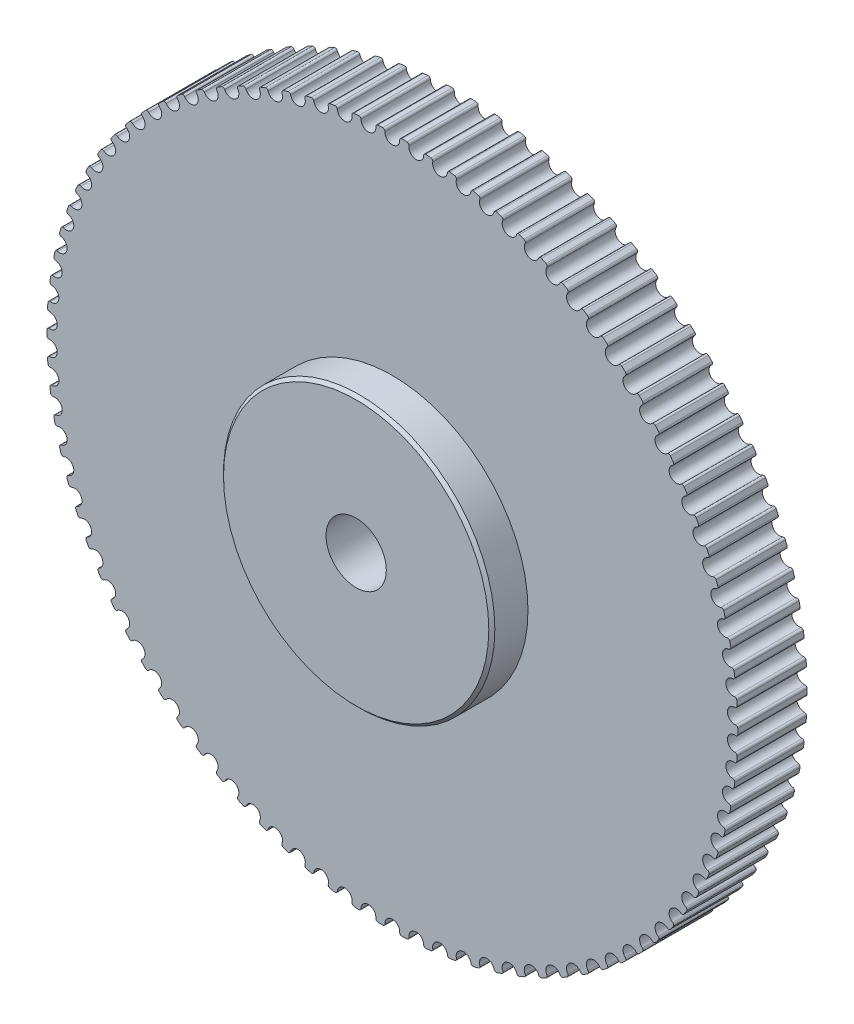
from build123d import *

# Parameters (mm, degrees)
Y_KSEKLIK_EKSTR_ZYON1_DEPTH = 23
IZIM2_R                     = 45
Y_KSEKLIK_EKSTR_ZYON2_DEPTH = 12
IZIM3_R                     = 10
KES_EKSTR_ZYON1_DEPTH       = 94
PAH1_SIZE                   = 1


with BuildPart() as part:
    # Çizim1 → Yükseklik-Ekstrüzyon1 (new body)
    with BuildSketch(Plane.XY):
        with BuildLine():
            ThreePointArc((0, 111.23), (1.781971913, 111.994070727), (2.456990514, 113.811645447))
            ThreePointArc((2.456990514, 113.811645447), (2.655804987, 114.335821771), (3.175532645, 114.545991167))
            ThreePointArc((3.175532645, 114.545991167), (3.999133327, 114.520194868), (4.822527218, 114.488476849))
            ThreePointArc((4.822527218, 114.488476849), (5.32632817, 114.242565047), (5.488093649, 113.705796993))
            ThreePointArc((5.488093649, 113.705796993), (6.034680335, 111.845562876), (7.759012575, 110.95904931))
            ThreePointArc((7.759012575, 110.95904931), (9.589942573, 111.596954722), (10.390104466, 113.363015005))
            ThreePointArc((10.390104466, 113.363015005), (10.624999329, 113.872045865), (11.158121632, 114.04544893))
            ThreePointArc((11.158121632, 114.04544893), (11.977916606, 113.96226399), (12.797092214, 113.87318618))
            ThreePointArc((12.797092214, 113.87318618), (13.282511991, 113.592730029), (13.406440371, 113.045985326))
            ThreePointArc((13.406440371, 113.045985326), (13.821932227, 111.152154686), (15.48022402, 110.147517286))
            ThreePointArc((15.48022402, 110.147517286), (17.351191997, 110.656149572), (18.272598873, 112.362091348))
            ThreePointArc((18.272598873, 112.362091348), (18.542429742, 112.853496798), (19.086349373, 112.98928873))
            ThreePointArc((19.086349373, 112.98928873), (19.898344679, 112.849120418), (20.709311062, 112.703116795))
            ThreePointArc((20.709311062, 112.703116795), (21.173984749, 112.389482649), (21.259472264, 111.835424982))
            ThreePointArc((21.259472264, 111.835424982), (21.541845055, 109.917224371), (23.12601737, 108.79935763))
            ThreePointArc((23.12601737, 108.79935763), (25.027908158, 109.176238784), (26.066071016, 110.813750878))
            ThreePointArc((26.066071016, 110.813750878), (26.369523302, 111.285136838), (26.921590338, 111.382656072))
            ThreePointArc((26.921590338, 111.382656072), (27.721830017, 111.186187274), (28.520636229, 110.983969154))
            ThreePointArc((28.520636229, 110.983969154), (28.962299982, 110.638685006), (29.008930144, 110.080013689))
            ThreePointArc((29.008930144, 110.080013689), (29.156808179, 108.146788388), (30.659143088, 106.921138439))
            ThreePointArc((30.659143088, 106.921138439), (32.582690866, 107.164432335), (33.73255188, 108.725536952))
            ThreePointArc((33.73255188, 108.725536952), (34.068147194, 109.174606878), (34.625672021, 109.233378311))
            ThreePointArc((34.625672021, 109.233378311), (35.410257385, 108.981566202), (36.193011723, 108.724118771))
            ThreePointArc((36.193011723, 108.724118771), (36.609513801, 108.348866812), (36.617059433, 107.788303634))
            ThreePointArc((36.617059433, 107.788303634), (36.629722264, 105.849472123), (38.042900542, 104.52201021))
            ThreePointArc((38.042900542, 104.52201021), (39.978733979, 104.630531544), (41.234691143, 106.107623138))
            ThreePointArc((41.234691143, 106.107623138), (41.600794498, 106.532189208), (42.16106091, 106.55192651))
            ThreePointArc((42.16106091, 106.55192651), (42.92616954, 106.245997895), (43.689058502, 105.93457541))
            ThreePointArc((43.689058502, 105.93457541), (44.078369748, 105.53118383), (44.046794089, 104.971459799))
            ThreePointArc((44.046794089, 104.971459799), (43.924180025, 103.036467869), (45.241316809, 101.613661254))
            ThreePointArc((45.241316809, 101.613661254), (47.180004719, 101.586881321), (48.535939136, 102.972763651))
            ThreePointArc((48.535939136, 102.972763651), (48.930766913, 103.37075742), (49.491045348, 103.351364434))
            ThreePointArc((49.491045348, 103.351364434), (50.232949711, 102.992809765), (50.972256579, 102.628929446))
            ThreePointArc((50.972256579, 102.628929446), (51.332480309, 102.199363528), (51.261937191, 101.643205563))
            ThreePointArc((51.261937191, 101.643205563), (51.004643595, 99.721480302), (52.219321929, 98.210260754))
            ThreePointArc((52.219321929, 98.210260754), (54.151419218, 98.048310024), (55.600724911, 99.336231211))
            ThreePointArc((55.600724911, 99.336231211), (56.02235355, 99.705713693), (56.579914389, 99.647284899))
            ThreePointArc((56.579914389, 99.647284899), (57.295, 99.23785102), (58.007122946, 98.823285654))
            ThreePointArc((58.007122946, 98.823285654), (58.336504185, 98.3696382), (58.227337289, 97.819755847))
            ThreePointArc((58.227337289, 97.819755847), (57.836617669, 95.920659706), (58.942919761, 94.328389735))
            ThreePointArc((58.942919761, 94.328389735), (60.859013447, 94.032057215), (62.394629544, 95.215742637))
            ThreePointArc((62.394629544, 95.215742637), (62.841004911, 95.554913751), (63.393131774, 95.457733809))
            ThreePointArc((63.393131774, 95.457733809), (64.077914809, 94.999415439), (64.759384441, 94.536184748))
            ThreePointArc((64.759384441, 94.536184748), (65.056318478, 94.060665883), (64.909059652, 93.519738114))
            ThreePointArc((64.909059652, 93.519738114), (64.386817556, 91.652523298), (65.379353612, 89.986960284))
            ThreePointArc((65.379353612, 89.986960284), (67.270108679, 89.557689676), (68.884553814, 90.631372535))
            ThreePointArc((68.884553814, 90.631372535), (69.353501214, 90.938579874), (69.897504193, 90.803122235))
            ThreePointArc((69.897504193, 90.803122235), (70.548648458, 90.298152256), (71.196144725, 89.788513053))
            ThreePointArc((71.196144725, 89.788513053), (71.459184926, 89.293439457), (71.274551602, 88.764101616))
            ThreePointArc((71.274551602, 88.764101616), (70.623331339, 86.937865009), (71.497265825, 85.207123408))
            ThreePointArc((71.497265825, 85.207123408), (73.353470704, 84.647006076), (75.038879461, 85.605455498))
            ThreePointArc((75.038879461, 85.605455498), (75.52811423, 85.879202378), (76.061342998, 85.706126977))
            ThreePointArc((76.061342998, 85.706126977), (76.675676183, 85.156965551), (77.286044548, 84.603400748))
            ThreePointArc((77.286044548, 84.603400748), (77.513909408, 84.091184369), (77.2928011, 83.576015339))
            ThreePointArc((77.2928011, 83.576015339), (76.515775352, 81.799654181), (77.266850546, 80.012165992))
            ThreePointArc((77.266850546, 80.012165992), (79.079461992, 79.32393077), (80.827623231, 80.162477286))
            ThreePointArc((80.827623231, 80.162477286), (81.334761866, 80.40143004), (81.854618585, 80.191580083))
            ThreePointArc((81.854618585, 80.191580083), (82.429147721, 79.600902671), (82.999414531, 79.006109179))
            ThreePointArc((82.999414531, 79.006109179), (83.190993915, 78.479245484), (82.934487841, 77.980755115))
            ThreePointArc((82.934487841, 77.980755115), (82.035442198, 76.262923661), (82.659998938, 74.427397345))
            ThreePointArc((82.659998938, 74.427397345), (84.420186092, 73.614397247), (86.222582945, 74.328955542))
            ThreePointArc((86.222582945, 74.328955542), (86.745154717, 74.531950017), (87.249106699, 74.286347872))
            ThreePointArc((87.249106699, 74.286347872), (87.781032737, 73.657032194), (88.308419709, 73.023907787))
            ThreePointArc((88.308419709, 73.023907787), (88.462780262, 72.484963603), (88.172126093, 72.005580492))
            ThreePointArc((88.172126093, 72.005580492), (87.155440616, 70.354647842), (87.650436124, 68.4800259))
            ThreePointArc((87.650436124, 68.4800259), (89.34962353, 67.546221781), (91.197474903, 68.133310599))
            ThreePointArc((91.197474903, 68.133310599), (91.732933895, 68.299357825), (92.218525935, 68.019200042))
            ThreePointArc((92.218525935, 68.019200042), (92.705257385, 67.35431206), (93.187195143, 66.685941257))
            ThreePointArc((93.187195143, 66.685941257), (93.303584836, 66.137542267), (92.980198611, 65.679601918))
            ThreePointArc((92.980198611, 65.679601918), (91.850826488, 64.103611251), (92.213849195, 62.199026653))
            ThreePointArc((92.213849195, 62.199026653), (93.843758584, 61.148967912), (95.728061929, 61.605727015))
            ThreePointArc((95.728061929, 61.605727015), (96.273799439, 61.734018027), (96.738665783, 61.420669506))
            ThreePointArc((96.738665783, 61.420669506), (97.177831339, 60.723448488), (97.61197193, 60.023087525))
            ThreePointArc((97.61197193, 60.023087525), (97.689823723, 59.467905472), (97.335280947, 59.033638925))
            ThreePointArc((97.335280947, 59.033638925), (96.098724366, 57.540268309), (96.328005663, 55.615))
            ThreePointArc((96.328005663, 55.615), (97.880696279, 54.453802418), (99.792271461, 54.778006522))
            ThreePointArc((99.792271461, 54.778006522), (100.34562871, 54.867916299), (100.787504575, 54.522903642))
            ThreePointArc((100.787504575, 54.522903642), (101.176964666, 53.79674638), (101.561193001, 53.067807343))
            ThreePointArc((101.561193001, 53.067807343), (101.600127609, 52.508547019), (101.216155578, 52.100069978))
            ThreePointArc((101.216155578, 52.100069978), (99.878438919, 50.696594964), (99.97286177, 48.760022657))
            ThreePointArc((99.97286177, 48.760022657), (101.440769061, 47.493343472), (103.370303077, 47.683413087))
            ThreePointArc((103.370303077, 47.683413087), (103.928584164, 47.734503598), (104.345316776, 47.359507673))
            ThreePointArc((104.345316776, 47.359507673), (104.683173991, 46.60795193), (105.015618149, 45.853986139))
            ThreePointArc((105.015618149, 45.853986139), (105.015445886, 45.293372204), (104.603915274, 44.912674727))
            ThreePointArc((104.603915274, 44.912674727), (103.171555757, 43.605932905), (103.130660143, 41.667491386))
            ThreePointArc((103.130660143, 41.667491386), (104.506632613, 40.30150173), (106.444724967, 40.356510857))
            ThreePointArc((106.444724967, 40.356510857), (107.005210004, 40.368533194), (107.394769082, 39.965380942))
            ThreePointArc((107.394769082, 39.965380942), (107.679377416, 39.192088224), (107.958417761, 38.416768923))
            ThreePointArc((107.958417761, 38.416768923), (107.919139467, 37.857532632), (107.482055209, 37.50646944))
            ThreePointArc((107.482055209, 37.50646944), (105.962031146, 36.302827124), (105.786016308, 34.371960284))
            ThreePointArc((105.786016308, 34.371960284), (107.063350356, 32.913315124), (109.000558857, 32.832995762))
            ThreePointArc((109.000558857, 32.832995762), (109.560517216, 32.805891354), (109.921004868, 32.376546893))
            ThreePointArc((109.921004868, 32.376546893), (110.150977738, 31.585284603), (110.375254814, 30.792389071))
            ThreePointArc((110.375254814, 30.792389071), (110.297061848, 30.237254967), (109.836553375, 29.917536403))
            ThreePointArc((109.836553375, 29.917536403), (108.236270171, 28.822857618), (107.925993634, 26.908972448))
            ThreePointArc((107.925993634, 26.908972448), (109.098466218, 25.364778154), (111.02535298, 25.149521613))
            ThreePointArc((111.02535298, 25.149521613), (111.582056602, 25.083422509), (111.911716568, 24.629977562))
            ThreePointArc((111.911716568, 24.629977562), (112.085933568, 23.824600651), (112.254354721, 23.017991794))
            ThreePointArc((112.254354721, 23.017991794), (112.137628031, 22.469664434), (111.655938894, 22.182848136))
            ThreePointArc((111.655938894, 22.182848136), (109.983192968, 21.202466047), (109.540166368, 19.314886802))
            ThreePointArc((109.540166368, 19.314886802), (110.602065318, 17.692666535), (112.509242745, 17.343521522))
            ThreePointArc((112.509242745, 17.343521522), (113.059979424, 17.238749751), (113.357205635, 16.763413456))
            ThreePointArc((113.357205635, 16.763413456), (113.474817997, 15.947845639), (113.586562695, 15.131453175))
            ThreePointArc((113.586562695, 15.131453175), (113.431870962, 14.592603956), (112.931347902, 14.340087263))
            ThreePointArc((112.931347902, 14.340087263), (111.194288703, 13.478778193), (110.620670422, 11.626700969))
            ThreePointArc((110.620670422, 11.626700969), (111.566822275, 9.934358023), (113.444998788, 9.453025538))
            ThreePointArc((113.444998788, 9.453025538), (113.98708539, 9.310091537), (114.25042979, 8.815179685))
            ThreePointArc((114.25042979, 8.815179685), (114.310864519, 7.993394326), (114.365388353, 7.171195637))
            ThreePointArc((114.365388353, 7.171195637), (114.17348522, 6.644449777), (113.656566736, 6.427462927))
            ThreePointArc((113.656566736, 6.427462927), (111.863657042, 5.689423086), (111.162241689, 3.881871018))
            ThreePointArc((111.162241689, 3.881871018), (111.988036888, 2.127650318), (113.8280622, 1.516475363))
            ThreePointArc((113.8280622, 1.516475363), (114.358857735, 1.336075493), (114.587037335, 0.823999245))
            ThreePointArc((114.587037335, 0.823999245), (114.59, 0), (114.587037335, -0.823999245))
            ThreePointArc((114.587037335, -0.823999245), (114.358857735, -1.336075493), (113.8280622, -1.516475363))
            ThreePointArc((113.8280622, -1.516475363), (111.988036888, -2.127650318), (111.162241689, -3.881871018))
            ThreePointArc((111.162241689, -3.881871018), (111.863657042, -5.689423086), (113.656566736, -6.427462927))
            ThreePointArc((113.656566736, -6.427462927), (114.17348522, -6.644449777), (114.365388353, -7.171195637))
            ThreePointArc((114.365388353, -7.171195637), (114.310864519, -7.993394326), (114.25042979, -8.815179685))
            ThreePointArc((114.25042979, -8.815179685), (113.98708539, -9.310091537), (113.444998788, -9.453025538))
            ThreePointArc((113.444998788, -9.453025538), (111.566822275, -9.934358023), (110.620670422, -11.626700969))
            ThreePointArc((110.620670422, -11.626700969), (111.194288703, -13.478778193), (112.931347902, -14.340087263))
            ThreePointArc((112.931347902, -14.340087263), (113.431870962, -14.592603956), (113.586562695, -15.131453175))
            ThreePointArc((113.586562695, -15.131453175), (113.474817997, -15.947845639), (113.357205635, -16.763413456))
            ThreePointArc((113.357205635, -16.763413456), (113.059979424, -17.238749751), (112.509242745, -17.343521522))
            ThreePointArc((112.509242745, -17.343521522), (110.602065318, -17.692666535), (109.540166368, -19.314886802))
            ThreePointArc((109.540166368, -19.314886802), (109.983192968, -21.202466047), (111.655938894, -22.182848136))
            ThreePointArc((111.655938894, -22.182848136), (112.137628031, -22.469664434), (112.254354721, -23.017991794))
            ThreePointArc((112.254354721, -23.017991794), (112.085933568, -23.824600651), (111.911716568, -24.629977562))
            ThreePointArc((111.911716568, -24.629977562), (111.582056602, -25.083422509), (111.02535298, -25.149521613))
            ThreePointArc((111.02535298, -25.149521613), (109.098466218, -25.364778154), (107.925993634, -26.908972448))
            ThreePointArc((107.925993634, -26.908972448), (108.236270171, -28.822857618), (109.836553375, -29.917536403))
            ThreePointArc((109.836553375, -29.917536403), (110.297061848, -30.237254967), (110.375254814, -30.792389071))
            ThreePointArc((110.375254814, -30.792389071), (110.150977738, -31.585284603), (109.921004868, -32.376546893))
            ThreePointArc((109.921004868, -32.376546893), (109.560517216, -32.805891354), (109.000558857, -32.832995762))
            ThreePointArc((109.000558857, -32.832995762), (107.063350356, -32.913315124), (105.786016308, -34.371960284))
            ThreePointArc((105.786016308, -34.371960284), (105.962031146, -36.302827124), (107.482055209, -37.50646944))
            ThreePointArc((107.482055209, -37.50646944), (107.919139467, -37.857532632), (107.958417761, -38.416768923))
            ThreePointArc((107.958417761, -38.416768923), (107.679377416, -39.192088224), (107.394769082, -39.965380942))
            ThreePointArc((107.394769082, -39.965380942), (107.005210004, -40.368533194), (106.444724967, -40.356510857))
            ThreePointArc((106.444724967, -40.356510857), (104.506632613, -40.30150173), (103.130660143, -41.667491386))
            ThreePointArc((103.130660143, -41.667491386), (103.171555757, -43.605932905), (104.603915274, -44.912674727))
            ThreePointArc((104.603915274, -44.912674727), (105.015445886, -45.293372204), (105.015618149, -45.853986139))
            ThreePointArc((105.015618149, -45.853986139), (104.683173991, -46.60795193), (104.345316776, -47.359507673))
            ThreePointArc((104.345316776, -47.359507673), (103.928584164, -47.734503598), (103.370303077, -47.683413087))
            ThreePointArc((103.370303077, -47.683413087), (101.440769061, -47.493343472), (99.97286177, -48.760022657))
            ThreePointArc((99.97286177, -48.760022657), (99.878438919, -50.696594964), (101.216155578, -52.100069978))
            ThreePointArc((101.216155578, -52.100069978), (101.600127609, -52.508547019), (101.561193001, -53.067807343))
            ThreePointArc((101.561193001, -53.067807343), (101.176964666, -53.79674638), (100.787504575, -54.522903642))
            ThreePointArc((100.787504575, -54.522903642), (100.34562871, -54.867916299), (99.792271461, -54.778006522))
            ThreePointArc((99.792271461, -54.778006522), (97.880696279, -54.453802418), (96.328005663, -55.615))
            ThreePointArc((96.328005663, -55.615), (96.098724366, -57.540268309), (97.335280947, -59.033638925))
            ThreePointArc((97.335280947, -59.033638925), (97.689823723, -59.467905472), (97.61197193, -60.023087525))
            ThreePointArc((97.61197193, -60.023087525), (97.177831339, -60.723448488), (96.738665783, -61.420669506))
            ThreePointArc((96.738665783, -61.420669506), (96.273799439, -61.734018027), (95.728061929, -61.605727015))
            ThreePointArc((95.728061929, -61.605727015), (93.843758584, -61.148967912), (92.213849195, -62.199026653))
            ThreePointArc((92.213849195, -62.199026653), (91.850826488, -64.103611251), (92.980198611, -65.679601918))
            ThreePointArc((92.980198611, -65.679601918), (93.303584836, -66.137542267), (93.187195143, -66.685941257))
            ThreePointArc((93.187195143, -66.685941257), (92.705257385, -67.35431206), (92.218525935, -68.019200042))
            ThreePointArc((92.218525935, -68.019200042), (91.732933895, -68.299357825), (91.197474903, -68.133310599))
            ThreePointArc((91.197474903, -68.133310599), (89.34962353, -67.546221781), (87.650436124, -68.4800259))
            ThreePointArc((87.650436124, -68.4800259), (87.155440616, -70.354647842), (88.172126093, -72.005580492))
            ThreePointArc((88.172126093, -72.005580492), (88.462780262, -72.484963603), (88.308419709, -73.023907787))
            ThreePointArc((88.308419709, -73.023907787), (87.781032737, -73.657032194), (87.249106699, -74.286347872))
            ThreePointArc((87.249106699, -74.286347872), (86.745154717, -74.531950017), (86.222582945, -74.328955542))
            ThreePointArc((86.222582945, -74.328955542), (84.420186092, -73.614397247), (82.659998938, -74.427397345))
            ThreePointArc((82.659998938, -74.427397345), (82.035442198, -76.262923661), (82.934487841, -77.980755115))
            ThreePointArc((82.934487841, -77.980755115), (83.190993915, -78.479245484), (82.999414531, -79.006109179))
            ThreePointArc((82.999414531, -79.006109179), (82.429147721, -79.600902671), (81.854618585, -80.191580083))
            ThreePointArc((81.854618585, -80.191580083), (81.334761866, -80.40143004), (80.827623231, -80.162477286))
            ThreePointArc((80.827623231, -80.162477286), (79.079461992, -79.32393077), (77.266850546, -80.012165992))
            ThreePointArc((77.266850546, -80.012165992), (76.515775352, -81.799654181), (77.2928011, -83.576015339))
            ThreePointArc((77.2928011, -83.576015339), (77.513909408, -84.091184369), (77.286044548, -84.603400748))
            ThreePointArc((77.286044548, -84.603400748), (76.675676183, -85.156965551), (76.061342998, -85.706126977))
            ThreePointArc((76.061342998, -85.706126977), (75.52811423, -85.879202378), (75.038879461, -85.605455498))
            ThreePointArc((75.038879461, -85.605455498), (73.353470704, -84.647006076), (71.497265825, -85.207123408))
            ThreePointArc((71.497265825, -85.207123408), (70.623331339, -86.937865009), (71.274551602, -88.764101616))
            ThreePointArc((71.274551602, -88.764101616), (71.459184926, -89.293439457), (71.196144725, -89.788513053))
            ThreePointArc((71.196144725, -89.788513053), (70.548648458, -90.298152256), (69.897504193, -90.803122235))
            ThreePointArc((69.897504193, -90.803122235), (69.353501214, -90.938579874), (68.884553814, -90.631372535))
            ThreePointArc((68.884553814, -90.631372535), (67.270108679, -89.557689676), (65.379353613, -89.986960284))
            ThreePointArc((65.379353613, -89.986960284), (64.386817556, -91.652523298), (64.909059652, -93.519738114))
            ThreePointArc((64.909059652, -93.519738114), (65.056318478, -94.060665883), (64.759384441, -94.536184748))
            ThreePointArc((64.759384441, -94.536184748), (64.077914809, -94.999415439), (63.393131774, -95.457733809))
            ThreePointArc((63.393131774, -95.457733809), (62.841004911, -95.554913751), (62.394629544, -95.215742637))
            ThreePointArc((62.394629544, -95.215742637), (60.859013447, -94.032057215), (58.942919761, -94.328389735))
            ThreePointArc((58.942919761, -94.328389735), (57.836617669, -95.920659706), (58.227337289, -97.819755847))
            ThreePointArc((58.227337289, -97.819755847), (58.336504186, -98.3696382), (58.007122946, -98.823285654))
            ThreePointArc((58.007122946, -98.823285654), (57.295, -99.23785102), (56.579914389, -99.647284899))
            ThreePointArc((56.579914389, -99.647284899), (56.02235355, -99.705713693), (55.600724911, -99.336231211))
            ThreePointArc((55.600724911, -99.336231211), (54.151419218, -98.048310024), (52.219321929, -98.210260754))
            ThreePointArc((52.219321929, -98.210260754), (51.004643595, -99.721480302), (51.261937191, -101.643205563))
            ThreePointArc((51.261937191, -101.643205563), (51.332480309, -102.199363528), (50.972256579, -102.628929446))
            ThreePointArc((50.972256579, -102.628929446), (50.232949711, -102.992809765), (49.491045348, -103.351364434))
            ThreePointArc((49.491045348, -103.351364434), (48.930766913, -103.37075742), (48.535939136, -102.972763651))
            ThreePointArc((48.535939136, -102.972763651), (47.180004719, -101.586881321), (45.241316809, -101.613661254))
            ThreePointArc((45.241316809, -101.613661254), (43.924180025, -103.036467869), (44.046794089, -104.971459799))
            ThreePointArc((44.046794089, -104.971459799), (44.078369748, -105.53118383), (43.689058502, -105.93457541))
            ThreePointArc((43.689058502, -105.93457541), (42.92616954, -106.245997895), (42.16106091, -106.55192651))
            ThreePointArc((42.16106091, -106.55192651), (41.600794498, -106.532189208), (41.234691143, -106.107623138))
            ThreePointArc((41.234691143, -106.107623138), (39.978733979, -104.630531544), (38.042900542, -104.52201021))
            ThreePointArc((38.042900542, -104.52201021), (36.629722264, -105.849472123), (36.617059433, -107.788303634))
            ThreePointArc((36.617059433, -107.788303634), (36.609513801, -108.348866812), (36.193011723, -108.724118771))
            ThreePointArc((36.193011723, -108.724118771), (35.410257385, -108.981566202), (34.625672021, -109.233378311))
            ThreePointArc((34.625672021, -109.233378311), (34.068147194, -109.174606878), (33.73255188, -108.725536952))
            ThreePointArc((33.73255188, -108.725536952), (32.582690866, -107.164432335), (30.659143088, -106.921138439))
            ThreePointArc((30.659143088, -106.921138439), (29.156808179, -108.146788388), (29.008930144, -110.080013689))
            ThreePointArc((29.008930144, -110.080013689), (28.962299982, -110.638685006), (28.520636229, -110.983969154))
            ThreePointArc((28.520636229, -110.983969154), (27.721830017, -111.186187274), (26.921590338, -111.382656072))
            ThreePointArc((26.921590338, -111.382656072), (26.369523302, -111.285136838), (26.066071016, -110.813750878))
            ThreePointArc((26.066071016, -110.813750878), (25.027908158, -109.176238784), (23.12601737, -108.79935763))
            ThreePointArc((23.12601737, -108.79935763), (21.541845055, -109.917224371), (21.259472264, -111.835424982))
            ThreePointArc((21.259472264, -111.835424982), (21.173984749, -112.389482649), (20.709311062, -112.703116795))
            ThreePointArc((20.709311062, -112.703116795), (19.898344679, -112.849120418), (19.086349373, -112.98928873))
            ThreePointArc((19.086349373, -112.98928873), (18.542429742, -112.853496798), (18.272598873, -112.362091348))
            ThreePointArc((18.272598873, -112.362091348), (17.351191997, -110.656149572), (15.48022402, -110.147517286))
            ThreePointArc((15.48022402, -110.147517286), (13.821932227, -111.152154686), (13.406440371, -113.045985326))
            ThreePointArc((13.406440371, -113.045985326), (13.282511991, -113.592730029), (12.797092214, -113.87318618))
            ThreePointArc((12.797092214, -113.87318618), (11.977916606, -113.96226399), (11.158121632, -114.04544893))
            ThreePointArc((11.158121632, -114.04544893), (10.624999329, -113.872045865), (10.390104466, -113.363015005))
            ThreePointArc((10.390104466, -113.363015005), (9.589942573, -111.596954722), (7.759012575, -110.95904931))
            ThreePointArc((7.759012575, -110.95904931), (6.034680335, -111.845562876), (5.488093649, -113.705796993))
            ThreePointArc((5.488093649, -113.705796993), (5.32632817, -114.242565047), (4.822527218, -114.488476849))
            ThreePointArc((4.822527218, -114.488476849), (3.999133327, -114.520194868), (3.175532645, -114.545991167))
            ThreePointArc((3.175532645, -114.545991167), (2.655804987, -114.335821771), (2.456990514, -113.811645447))
            ThreePointArc((2.456990514, -113.811645447), (1.781971913, -111.994070727), (0, -111.23))
            ThreePointArc((0, -111.23), (-1.781971913, -111.994070727), (-2.456990514, -113.811645447))
            ThreePointArc((-2.456990514, -113.811645447), (-2.655804987, -114.335821771), (-3.175532645, -114.545991167))
            ThreePointArc((-3.175532645, -114.545991167), (-3.999133327, -114.520194868), (-4.822527218, -114.488476849))
            ThreePointArc((-4.822527218, -114.488476849), (-5.32632817, -114.242565047), (-5.488093649, -113.705796993))
            ThreePointArc((-5.488093649, -113.705796993), (-6.034680335, -111.845562876), (-7.759012575, -110.95904931))
            ThreePointArc((-7.759012575, -110.95904931), (-9.589942573, -111.596954722), (-10.390104466, -113.363015005))
            ThreePointArc((-10.390104466, -113.363015005), (-10.624999329, -113.872045865), (-11.158121632, -114.04544893))
            ThreePointArc((-11.158121632, -114.04544893), (-11.977916606, -113.96226399), (-12.797092214, -113.87318618))
            ThreePointArc((-12.797092214, -113.87318618), (-13.282511991, -113.592730029), (-13.406440371, -113.045985326))
            ThreePointArc((-13.406440371, -113.045985326), (-13.821932227, -111.152154686), (-15.48022402, -110.147517286))
            ThreePointArc((-15.48022402, -110.147517286), (-17.351191997, -110.656149572), (-18.272598873, -112.362091348))
            ThreePointArc((-18.272598873, -112.362091348), (-18.542429742, -112.853496798), (-19.086349373, -112.98928873))
            ThreePointArc((-19.086349373, -112.98928873), (-19.898344679, -112.849120418), (-20.709311062, -112.703116795))
            ThreePointArc((-20.709311062, -112.703116795), (-21.173984749, -112.389482649), (-21.259472264, -111.835424982))
            ThreePointArc((-21.259472264, -111.835424982), (-21.541845055, -109.917224371), (-23.12601737, -108.79935763))
            ThreePointArc((-23.12601737, -108.79935763), (-25.027908158, -109.176238784), (-26.066071016, -110.813750878))
            ThreePointArc((-26.066071016, -110.813750878), (-26.369523302, -111.285136838), (-26.921590338, -111.382656072))
            ThreePointArc((-26.921590338, -111.382656072), (-27.721830017, -111.186187274), (-28.520636229, -110.983969154))
            ThreePointArc((-28.520636229, -110.983969154), (-28.962299982, -110.638685006), (-29.008930144, -110.080013689))
            ThreePointArc((-29.008930144, -110.080013689), (-29.156808179, -108.146788388), (-30.659143088, -106.921138439))
            ThreePointArc((-30.659143088, -106.921138439), (-32.582690866, -107.164432335), (-33.73255188, -108.725536952))
            ThreePointArc((-33.73255188, -108.725536952), (-34.068147194, -109.174606878), (-34.625672021, -109.233378311))
            ThreePointArc((-34.625672021, -109.233378311), (-35.410257385, -108.981566202), (-36.193011723, -108.724118771))
            ThreePointArc((-36.193011723, -108.724118771), (-36.609513801, -108.348866812), (-36.617059433, -107.788303634))
            ThreePointArc((-36.617059433, -107.788303634), (-36.629722264, -105.849472123), (-38.042900542, -104.52201021))
            ThreePointArc((-38.042900542, -104.52201021), (-39.978733979, -104.630531544), (-41.234691143, -106.107623138))
            ThreePointArc((-41.234691143, -106.107623138), (-41.600794498, -106.532189208), (-42.16106091, -106.55192651))
            ThreePointArc((-42.16106091, -106.55192651), (-42.92616954, -106.245997895), (-43.689058502, -105.93457541))
            ThreePointArc((-43.689058502, -105.93457541), (-44.078369748, -105.53118383), (-44.046794089, -104.971459799))
            ThreePointArc((-44.046794089, -104.971459799), (-43.924180025, -103.036467869), (-45.241316809, -101.613661254))
            ThreePointArc((-45.241316809, -101.613661254), (-47.180004719, -101.586881321), (-48.535939136, -102.972763651))
            ThreePointArc((-48.535939136, -102.972763651), (-48.930766913, -103.37075742), (-49.491045348, -103.351364434))
            ThreePointArc((-49.491045348, -103.351364434), (-50.232949711, -102.992809765), (-50.972256579, -102.628929446))
            ThreePointArc((-50.972256579, -102.628929446), (-51.332480309, -102.199363528), (-51.261937191, -101.643205563))
            ThreePointArc((-51.261937191, -101.643205563), (-51.004643595, -99.721480302), (-52.219321929, -98.210260754))
            ThreePointArc((-52.219321929, -98.210260754), (-54.151419218, -98.048310024), (-55.600724911, -99.336231211))
            ThreePointArc((-55.600724911, -99.336231211), (-56.02235355, -99.705713693), (-56.579914389, -99.647284899))
            ThreePointArc((-56.579914389, -99.647284899), (-57.295, -99.23785102), (-58.007122946, -98.823285654))
            ThreePointArc((-58.007122946, -98.823285654), (-58.336504185, -98.3696382), (-58.227337289, -97.819755847))
            ThreePointArc((-58.227337289, -97.819755847), (-57.836617669, -95.920659706), (-58.942919761, -94.328389735))
            ThreePointArc((-58.942919761, -94.328389735), (-60.859013447, -94.032057215), (-62.394629544, -95.215742637))
            ThreePointArc((-62.394629544, -95.215742637), (-62.841004911, -95.554913751), (-63.393131774, -95.457733809))
            ThreePointArc((-63.393131774, -95.457733809), (-64.077914809, -94.999415439), (-64.759384441, -94.536184748))
            ThreePointArc((-64.759384441, -94.536184748), (-65.056318478, -94.060665883), (-64.909059652, -93.519738114))
            ThreePointArc((-64.909059652, -93.519738114), (-64.386817556, -91.652523298), (-65.379353612, -89.986960284))
            ThreePointArc((-65.379353612, -89.986960284), (-67.270108679, -89.557689676), (-68.884553814, -90.631372535))
            ThreePointArc((-68.884553814, -90.631372535), (-69.353501214, -90.938579874), (-69.897504193, -90.803122235))
            ThreePointArc((-69.897504193, -90.803122235), (-70.548648458, -90.298152256), (-71.196144725, -89.788513053))
            ThreePointArc((-71.196144725, -89.788513053), (-71.459184926, -89.293439457), (-71.274551602, -88.764101616))
            ThreePointArc((-71.274551602, -88.764101616), (-70.623331339, -86.937865009), (-71.497265825, -85.207123408))
            ThreePointArc((-71.497265825, -85.207123408), (-73.353470704, -84.647006076), (-75.038879461, -85.605455498))
            ThreePointArc((-75.038879461, -85.605455498), (-75.52811423, -85.879202378), (-76.061342998, -85.706126977))
            ThreePointArc((-76.061342998, -85.706126977), (-76.675676183, -85.156965551), (-77.286044548, -84.603400748))
            ThreePointArc((-77.286044548, -84.603400748), (-77.513909408, -84.091184369), (-77.2928011, -83.576015339))
            ThreePointArc((-77.2928011, -83.576015339), (-76.515775352, -81.799654181), (-77.266850546, -80.012165992))
            ThreePointArc((-77.266850546, -80.012165992), (-79.079461992, -79.32393077), (-80.827623231, -80.162477286))
            ThreePointArc((-80.827623231, -80.162477286), (-81.334761866, -80.40143004), (-81.854618585, -80.191580083))
            ThreePointArc((-81.854618585, -80.191580083), (-82.429147721, -79.600902671), (-82.999414531, -79.006109179))
            ThreePointArc((-82.999414531, -79.006109179), (-83.190993915, -78.479245484), (-82.934487841, -77.980755115))
            ThreePointArc((-82.934487841, -77.980755115), (-82.035442198, -76.262923661), (-82.659998938, -74.427397345))
            ThreePointArc((-82.659998938, -74.427397345), (-84.420186092, -73.614397247), (-86.222582945, -74.328955542))
            ThreePointArc((-86.222582945, -74.328955542), (-86.745154717, -74.531950017), (-87.249106699, -74.286347872))
            ThreePointArc((-87.249106699, -74.286347872), (-87.781032737, -73.657032194), (-88.308419709, -73.023907787))
            ThreePointArc((-88.308419709, -73.023907787), (-88.462780262, -72.484963603), (-88.172126093, -72.005580492))
            ThreePointArc((-88.172126093, -72.005580492), (-87.155440616, -70.354647842), (-87.650436124, -68.4800259))
            ThreePointArc((-87.650436124, -68.4800259), (-89.34962353, -67.546221781), (-91.197474903, -68.133310599))
            ThreePointArc((-91.197474903, -68.133310599), (-91.732933895, -68.299357825), (-92.218525935, -68.019200042))
            ThreePointArc((-92.218525935, -68.019200042), (-92.705257385, -67.35431206), (-93.187195143, -66.685941257))
            ThreePointArc((-93.187195143, -66.685941257), (-93.303584836, -66.137542267), (-92.980198611, -65.679601918))
            ThreePointArc((-92.980198611, -65.679601918), (-91.850826488, -64.103611251), (-92.213849195, -62.199026653))
            ThreePointArc((-92.213849195, -62.199026653), (-93.843758584, -61.148967912), (-95.728061929, -61.605727015))
            ThreePointArc((-95.728061929, -61.605727015), (-96.273799439, -61.734018027), (-96.738665783, -61.420669506))
            ThreePointArc((-96.738665783, -61.420669506), (-97.177831339, -60.723448488), (-97.61197193, -60.023087525))
            ThreePointArc((-97.61197193, -60.023087525), (-97.689823723, -59.467905472), (-97.335280947, -59.033638925))
            ThreePointArc((-97.335280947, -59.033638925), (-96.098724366, -57.540268309), (-96.328005663, -55.615))
            ThreePointArc((-96.328005663, -55.615), (-97.880696279, -54.453802418), (-99.792271461, -54.778006522))
            ThreePointArc((-99.792271461, -54.778006522), (-100.34562871, -54.867916299), (-100.787504575, -54.522903642))
            ThreePointArc((-100.787504575, -54.522903642), (-101.176964666, -53.79674638), (-101.561193001, -53.067807343))
            ThreePointArc((-101.561193001, -53.067807343), (-101.600127609, -52.508547019), (-101.216155578, -52.100069978))
            ThreePointArc((-101.216155578, -52.100069978), (-99.878438919, -50.696594964), (-99.97286177, -48.760022657))
            ThreePointArc((-99.97286177, -48.760022657), (-101.440769061, -47.493343472), (-103.370303077, -47.683413087))
            ThreePointArc((-103.370303077, -47.683413087), (-103.928584164, -47.734503598), (-104.345316776, -47.359507673))
            ThreePointArc((-104.345316776, -47.359507673), (-104.683173991, -46.60795193), (-105.015618149, -45.853986139))
            ThreePointArc((-105.015618149, -45.853986139), (-105.015445886, -45.293372204), (-104.603915274, -44.912674727))
            ThreePointArc((-104.603915274, -44.912674727), (-103.171555757, -43.605932905), (-103.130660143, -41.667491386))
            ThreePointArc((-103.130660143, -41.667491386), (-104.506632613, -40.30150173), (-106.444724967, -40.356510857))
            ThreePointArc((-106.444724967, -40.356510857), (-107.005210004, -40.368533194), (-107.394769082, -39.965380942))
            ThreePointArc((-107.394769082, -39.965380942), (-107.679377416, -39.192088224), (-107.958417761, -38.416768923))
            ThreePointArc((-107.958417761, -38.416768923), (-107.919139467, -37.857532632), (-107.482055209, -37.50646944))
            ThreePointArc((-107.482055209, -37.50646944), (-105.962031146, -36.302827124), (-105.786016308, -34.371960284))
            ThreePointArc((-105.786016308, -34.371960284), (-107.063350356, -32.913315124), (-109.000558857, -32.832995762))
            ThreePointArc((-109.000558857, -32.832995762), (-109.560517216, -32.805891354), (-109.921004868, -32.376546893))
            ThreePointArc((-109.921004868, -32.376546893), (-110.150977738, -31.585284603), (-110.375254814, -30.792389071))
            ThreePointArc((-110.375254814, -30.792389071), (-110.297061848, -30.237254967), (-109.836553375, -29.917536403))
            ThreePointArc((-109.836553375, -29.917536403), (-108.236270171, -28.822857618), (-107.925993634, -26.908972448))
            ThreePointArc((-107.925993634, -26.908972448), (-109.098466218, -25.364778154), (-111.02535298, -25.149521613))
            ThreePointArc((-111.02535298, -25.149521613), (-111.582056602, -25.083422509), (-111.911716568, -24.629977562))
            ThreePointArc((-111.911716568, -24.629977562), (-112.085933568, -23.824600651), (-112.254354721, -23.017991794))
            ThreePointArc((-112.254354721, -23.017991794), (-112.137628031, -22.469664434), (-111.655938894, -22.182848136))
            ThreePointArc((-111.655938894, -22.182848136), (-109.983192968, -21.202466047), (-109.540166368, -19.314886802))
            ThreePointArc((-109.540166368, -19.314886802), (-110.602065318, -17.692666535), (-112.509242745, -17.343521522))
            ThreePointArc((-112.509242745, -17.343521522), (-113.059979424, -17.238749751), (-113.357205635, -16.763413456))
            ThreePointArc((-113.357205635, -16.763413456), (-113.474817997, -15.947845639), (-113.586562695, -15.131453175))
            ThreePointArc((-113.586562695, -15.131453175), (-113.431870962, -14.592603956), (-112.931347902, -14.340087263))
            ThreePointArc((-112.931347902, -14.340087263), (-111.194288703, -13.478778193), (-110.620670422, -11.626700969))
            ThreePointArc((-110.620670422, -11.626700969), (-111.566822275, -9.934358023), (-113.444998788, -9.453025538))
            ThreePointArc((-113.444998788, -9.453025538), (-113.98708539, -9.310091537), (-114.25042979, -8.815179685))
            ThreePointArc((-114.25042979, -8.815179685), (-114.310864519, -7.993394326), (-114.365388353, -7.171195637))
            ThreePointArc((-114.365388353, -7.171195637), (-114.17348522, -6.644449777), (-113.656566736, -6.427462927))
            ThreePointArc((-113.656566736, -6.427462927), (-111.863657042, -5.689423086), (-111.162241689, -3.881871018))
            ThreePointArc((-111.162241689, -3.881871018), (-111.988036888, -2.127650318), (-113.8280622, -1.516475363))
            ThreePointArc((-113.8280622, -1.516475363), (-114.358857735, -1.336075493), (-114.587037335, -0.823999245))
            ThreePointArc((-114.587037335, -0.823999245), (-114.59, 0), (-114.587037335, 0.823999245))
            ThreePointArc((-114.587037335, 0.823999245), (-114.358857735, 1.336075493), (-113.8280622, 1.516475363))
            ThreePointArc((-113.8280622, 1.516475363), (-111.988036888, 2.127650318), (-111.162241689, 3.881871018))
            ThreePointArc((-111.162241689, 3.881871018), (-111.863657042, 5.689423086), (-113.656566736, 6.427462927))
            ThreePointArc((-113.656566736, 6.427462927), (-114.17348522, 6.644449777), (-114.365388353, 7.171195637))
            ThreePointArc((-114.365388353, 7.171195637), (-114.310864519, 7.993394326), (-114.25042979, 8.815179685))
            ThreePointArc((-114.25042979, 8.815179685), (-113.98708539, 9.310091537), (-113.444998788, 9.453025538))
            ThreePointArc((-113.444998788, 9.453025538), (-111.566822275, 9.934358023), (-110.620670422, 11.626700969))
            ThreePointArc((-110.620670422, 11.626700969), (-111.194288703, 13.478778193), (-112.931347902, 14.340087263))
            ThreePointArc((-112.931347902, 14.340087263), (-113.431870962, 14.592603956), (-113.586562695, 15.131453175))
            ThreePointArc((-113.586562695, 15.131453175), (-113.474817997, 15.947845639), (-113.357205635, 16.763413456))
            ThreePointArc((-113.357205635, 16.763413456), (-113.059979424, 17.238749751), (-112.509242745, 17.343521522))
            ThreePointArc((-112.509242745, 17.343521522), (-110.602065318, 17.692666535), (-109.540166368, 19.314886802))
            ThreePointArc((-109.540166368, 19.314886802), (-109.983192968, 21.202466047), (-111.655938894, 22.182848136))
            ThreePointArc((-111.655938894, 22.182848136), (-112.137628031, 22.469664434), (-112.254354721, 23.017991794))
            ThreePointArc((-112.254354721, 23.017991794), (-112.085933568, 23.824600651), (-111.911716568, 24.629977562))
            ThreePointArc((-111.911716568, 24.629977562), (-111.582056602, 25.083422509), (-111.02535298, 25.149521613))
            ThreePointArc((-111.02535298, 25.149521613), (-109.098466218, 25.364778154), (-107.925993634, 26.908972448))
            ThreePointArc((-107.925993634, 26.908972448), (-108.236270171, 28.822857618), (-109.836553375, 29.917536403))
            ThreePointArc((-109.836553375, 29.917536403), (-110.297061848, 30.237254967), (-110.375254814, 30.792389071))
            ThreePointArc((-110.375254814, 30.792389071), (-110.150977738, 31.585284603), (-109.921004868, 32.376546893))
            ThreePointArc((-109.921004868, 32.376546893), (-109.560517216, 32.805891354), (-109.000558857, 32.832995762))
            ThreePointArc((-109.000558857, 32.832995762), (-107.063350356, 32.913315124), (-105.786016308, 34.371960284))
            ThreePointArc((-105.786016308, 34.371960284), (-105.962031146, 36.302827124), (-107.482055209, 37.50646944))
            ThreePointArc((-107.482055209, 37.50646944), (-107.919139467, 37.857532632), (-107.958417761, 38.416768923))
            ThreePointArc((-107.958417761, 38.416768923), (-107.679377416, 39.192088224), (-107.394769082, 39.965380942))
            ThreePointArc((-107.394769082, 39.965380942), (-107.005210004, 40.368533194), (-106.444724967, 40.356510857))
            ThreePointArc((-106.444724967, 40.356510857), (-104.506632613, 40.30150173), (-103.130660143, 41.667491386))
            ThreePointArc((-103.130660143, 41.667491386), (-103.171555757, 43.605932905), (-104.603915274, 44.912674727))
            ThreePointArc((-104.603915274, 44.912674727), (-105.015445886, 45.293372204), (-105.015618149, 45.853986139))
            ThreePointArc((-105.015618149, 45.853986139), (-104.683173991, 46.60795193), (-104.345316776, 47.359507673))
            ThreePointArc((-104.345316776, 47.359507673), (-103.928584164, 47.734503598), (-103.370303077, 47.683413087))
            ThreePointArc((-103.370303077, 47.683413087), (-101.440769061, 47.493343472), (-99.97286177, 48.760022657))
            ThreePointArc((-99.97286177, 48.760022657), (-99.878438919, 50.696594964), (-101.216155578, 52.100069978))
            ThreePointArc((-101.216155578, 52.100069978), (-101.600127609, 52.508547019), (-101.561193001, 53.067807343))
            ThreePointArc((-101.561193001, 53.067807343), (-101.176964666, 53.79674638), (-100.787504575, 54.522903642))
            ThreePointArc((-100.787504575, 54.522903642), (-100.34562871, 54.867916299), (-99.792271461, 54.778006522))
            ThreePointArc((-99.792271461, 54.778006522), (-97.880696279, 54.453802418), (-96.328005663, 55.615))
            ThreePointArc((-96.328005663, 55.615), (-96.098724366, 57.540268309), (-97.335280947, 59.033638925))
            ThreePointArc((-97.335280947, 59.033638925), (-97.689823723, 59.467905472), (-97.61197193, 60.023087525))
            ThreePointArc((-97.61197193, 60.023087525), (-97.177831339, 60.723448488), (-96.738665783, 61.420669506))
            ThreePointArc((-96.738665783, 61.420669506), (-96.273799439, 61.734018027), (-95.728061929, 61.605727015))
            ThreePointArc((-95.728061929, 61.605727015), (-93.843758584, 61.148967912), (-92.213849195, 62.199026653))
            ThreePointArc((-92.213849195, 62.199026653), (-91.850826488, 64.103611251), (-92.980198611, 65.679601918))
            ThreePointArc((-92.980198611, 65.679601918), (-93.303584836, 66.137542267), (-93.187195143, 66.685941257))
            ThreePointArc((-93.187195143, 66.685941257), (-92.705257385, 67.35431206), (-92.218525935, 68.019200042))
            ThreePointArc((-92.218525935, 68.019200042), (-91.732933895, 68.299357825), (-91.197474903, 68.133310599))
            ThreePointArc((-91.197474903, 68.133310599), (-89.34962353, 67.546221781), (-87.650436124, 68.4800259))
            ThreePointArc((-87.650436124, 68.4800259), (-87.155440616, 70.354647842), (-88.172126093, 72.005580492))
            ThreePointArc((-88.172126093, 72.005580492), (-88.462780262, 72.484963603), (-88.308419709, 73.023907787))
            ThreePointArc((-88.308419709, 73.023907787), (-87.781032737, 73.657032194), (-87.249106699, 74.286347872))
            ThreePointArc((-87.249106699, 74.286347872), (-86.745154717, 74.531950017), (-86.222582945, 74.328955542))
            ThreePointArc((-86.222582945, 74.328955542), (-84.420186092, 73.614397247), (-82.659998938, 74.427397345))
            ThreePointArc((-82.659998938, 74.427397345), (-82.035442198, 76.262923661), (-82.934487841, 77.980755115))
            ThreePointArc((-82.934487841, 77.980755115), (-83.190993915, 78.479245484), (-82.999414531, 79.006109179))
            ThreePointArc((-82.999414531, 79.006109179), (-82.429147721, 79.600902671), (-81.854618585, 80.191580083))
            ThreePointArc((-81.854618585, 80.191580083), (-81.334761866, 80.40143004), (-80.827623231, 80.162477286))
            ThreePointArc((-80.827623231, 80.162477286), (-79.079461992, 79.32393077), (-77.266850546, 80.012165992))
            ThreePointArc((-77.266850546, 80.012165992), (-76.515775352, 81.799654181), (-77.2928011, 83.576015339))
            ThreePointArc((-77.2928011, 83.576015339), (-77.513909408, 84.091184369), (-77.286044548, 84.603400748))
            ThreePointArc((-77.286044548, 84.603400748), (-76.675676183, 85.156965551), (-76.061342998, 85.706126977))
            ThreePointArc((-76.061342998, 85.706126977), (-75.52811423, 85.879202378), (-75.038879461, 85.605455498))
            ThreePointArc((-75.038879461, 85.605455498), (-73.353470704, 84.647006076), (-71.497265825, 85.207123408))
            ThreePointArc((-71.497265825, 85.207123408), (-70.623331339, 86.937865009), (-71.274551602, 88.764101616))
            ThreePointArc((-71.274551602, 88.764101616), (-71.459184926, 89.293439457), (-71.196144725, 89.788513053))
            ThreePointArc((-71.196144725, 89.788513053), (-70.548648458, 90.298152256), (-69.897504193, 90.803122235))
            ThreePointArc((-69.897504193, 90.803122235), (-69.353501214, 90.938579874), (-68.884553814, 90.631372535))
            ThreePointArc((-68.884553814, 90.631372535), (-67.270108679, 89.557689676), (-65.379353613, 89.986960284))
            ThreePointArc((-65.379353613, 89.986960284), (-64.386817556, 91.652523298), (-64.909059652, 93.519738114))
            ThreePointArc((-64.909059652, 93.519738114), (-65.056318478, 94.060665883), (-64.759384441, 94.536184748))
            ThreePointArc((-64.759384441, 94.536184748), (-64.077914809, 94.999415439), (-63.393131774, 95.457733809))
            ThreePointArc((-63.393131774, 95.457733809), (-62.841004911, 95.554913751), (-62.394629544, 95.215742637))
            ThreePointArc((-62.394629544, 95.215742637), (-60.859013447, 94.032057215), (-58.942919761, 94.328389735))
            ThreePointArc((-58.942919761, 94.328389735), (-57.836617669, 95.920659706), (-58.227337289, 97.819755847))
            ThreePointArc((-58.227337289, 97.819755847), (-58.336504186, 98.3696382), (-58.007122946, 98.823285654))
            ThreePointArc((-58.007122946, 98.823285654), (-57.295, 99.23785102), (-56.579914389, 99.647284899))
            ThreePointArc((-56.579914389, 99.647284899), (-56.02235355, 99.705713693), (-55.600724911, 99.336231211))
            ThreePointArc((-55.600724911, 99.336231211), (-54.151419218, 98.048310024), (-52.219321929, 98.210260754))
            ThreePointArc((-52.219321929, 98.210260754), (-51.004643595, 99.721480302), (-51.261937191, 101.643205563))
            ThreePointArc((-51.261937191, 101.643205563), (-51.332480309, 102.199363528), (-50.972256579, 102.628929446))
            ThreePointArc((-50.972256579, 102.628929446), (-50.232949711, 102.992809765), (-49.491045348, 103.351364434))
            ThreePointArc((-49.491045348, 103.351364434), (-48.930766913, 103.37075742), (-48.535939136, 102.972763651))
            ThreePointArc((-48.535939136, 102.972763651), (-47.180004719, 101.586881321), (-45.241316809, 101.613661254))
            ThreePointArc((-45.241316809, 101.613661254), (-43.924180025, 103.036467869), (-44.046794089, 104.971459799))
            ThreePointArc((-44.046794089, 104.971459799), (-44.078369748, 105.53118383), (-43.689058502, 105.93457541))
            ThreePointArc((-43.689058502, 105.93457541), (-42.92616954, 106.245997895), (-42.16106091, 106.55192651))
            ThreePointArc((-42.16106091, 106.55192651), (-41.600794498, 106.532189208), (-41.234691143, 106.107623138))
            ThreePointArc((-41.234691143, 106.107623138), (-39.978733979, 104.630531544), (-38.042900542, 104.52201021))
            ThreePointArc((-38.042900542, 104.52201021), (-36.629722264, 105.849472123), (-36.617059433, 107.788303634))
            ThreePointArc((-36.617059433, 107.788303634), (-36.609513801, 108.348866812), (-36.193011723, 108.724118771))
            ThreePointArc((-36.193011723, 108.724118771), (-35.410257385, 108.981566202), (-34.625672021, 109.233378311))
            ThreePointArc((-34.625672021, 109.233378311), (-34.068147194, 109.174606878), (-33.73255188, 108.725536952))
            ThreePointArc((-33.73255188, 108.725536952), (-32.582690866, 107.164432335), (-30.659143088, 106.921138439))
            ThreePointArc((-30.659143088, 106.921138439), (-29.156808179, 108.146788388), (-29.008930144, 110.080013689))
            ThreePointArc((-29.008930144, 110.080013689), (-28.962299982, 110.638685006), (-28.520636229, 110.983969154))
            ThreePointArc((-28.520636229, 110.983969154), (-27.721830017, 111.186187274), (-26.921590338, 111.382656072))
            ThreePointArc((-26.921590338, 111.382656072), (-26.369523302, 111.285136838), (-26.066071016, 110.813750878))
            ThreePointArc((-26.066071016, 110.813750878), (-25.027908158, 109.176238784), (-23.12601737, 108.79935763))
            ThreePointArc((-23.12601737, 108.79935763), (-21.541845055, 109.917224371), (-21.259472264, 111.835424982))
            ThreePointArc((-21.259472264, 111.835424982), (-21.173984749, 112.389482649), (-20.709311062, 112.703116795))
            ThreePointArc((-20.709311062, 112.703116795), (-19.898344679, 112.849120418), (-19.086349373, 112.98928873))
            ThreePointArc((-19.086349373, 112.98928873), (-18.542429742, 112.853496798), (-18.272598873, 112.362091348))
            ThreePointArc((-18.272598873, 112.362091348), (-17.351191997, 110.656149572), (-15.48022402, 110.147517286))
            ThreePointArc((-15.48022402, 110.147517286), (-13.821932227, 111.152154686), (-13.406440371, 113.045985326))
            ThreePointArc((-13.406440371, 113.045985326), (-13.282511991, 113.592730029), (-12.797092214, 113.87318618))
            ThreePointArc((-12.797092214, 113.87318618), (-11.977916606, 113.96226399), (-11.158121632, 114.04544893))
            ThreePointArc((-11.158121632, 114.04544893), (-10.624999329, 113.872045865), (-10.390104466, 113.363015005))
            ThreePointArc((-10.390104466, 113.363015005), (-9.589942573, 111.596954722), (-7.759012575, 110.95904931))
            ThreePointArc((-7.759012575, 110.95904931), (-6.034680335, 111.845562876), (-5.488093649, 113.705796993))
            ThreePointArc((-5.488093649, 113.705796993), (-5.32632817, 114.242565047), (-4.822527218, 114.488476849))
            ThreePointArc((-4.822527218, 114.488476849), (-3.999133327, 114.520194868), (-3.175532645, 114.545991167))
            ThreePointArc((-3.175532645, 114.545991167), (-2.655804987, 114.335821771), (-2.456990514, 113.811645447))
            ThreePointArc((-2.456990514, 113.811645447), (-1.781971913, 111.994070727), (0, 111.23))
        make_face()
    extrude(amount=Y_KSEKLIK_EKSTR_ZYON1_DEPTH)

    # Çizim2 → Yükseklik-Ekstrüzyon2 (add)
    with BuildSketch(Plane.XY.offset(23)):
        Circle(IZIM2_R)
    extrude(amount=Y_KSEKLIK_EKSTR_ZYON2_DEPTH)

    # Çizim3 → Kes-Ekstrüzyon1 (cut)
    with BuildSketch(Plane.XY.offset(35)):
        Circle(IZIM3_R)
    extrude(amount=-KES_EKSTR_ZYON1_DEPTH, mode=Mode.SUBTRACT)

    # Pah1
    pah1_edges = [part.edges().sort_by_distance(p)[0] for p in [
        (-45, 0, 35),
    ]]
    chamfer(pah1_edges, length=PAH1_SIZE)


solid = part.part
